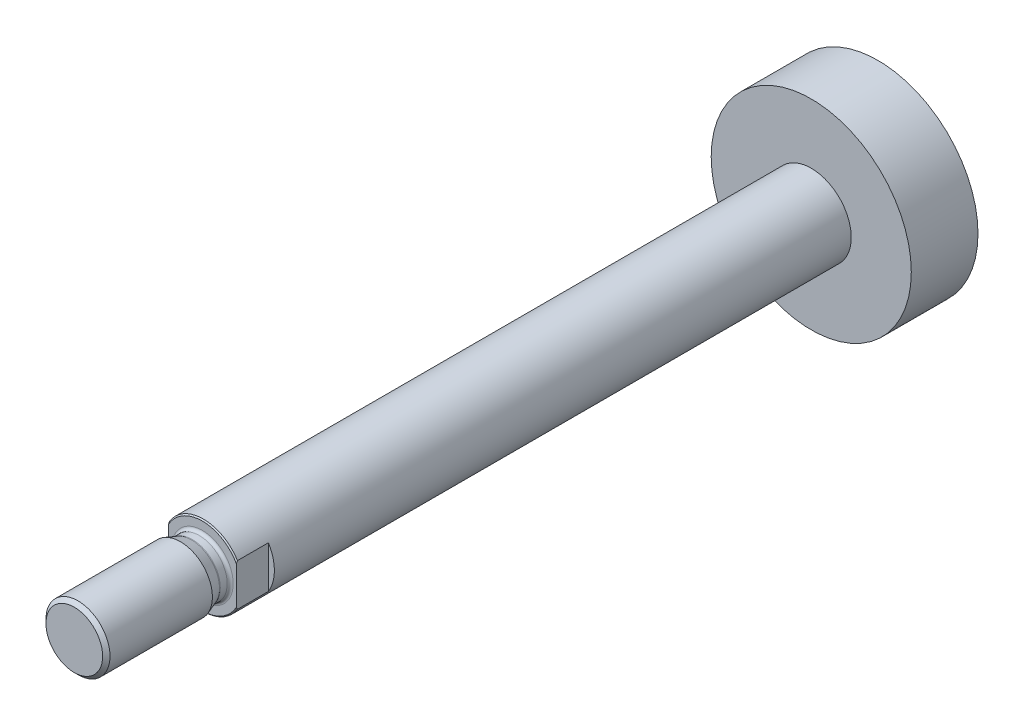
from build123d import *

# Parameters (mm, degrees)
CUT_EXTRUDE1_DEPTH      = 17
CUT_EXTRUDE1_DEPTH_BACK = 17


with BuildPart() as part:
    # Sketch1 → Revolve1 (revolve)
    with BuildSketch(Plane(origin=(0, 0, 0), x_dir=(0, 0, -1), z_dir=(1, 0, 0))):
        Polygon((-35.8, 0), (-35.8, 9.717157288), (-35.517157288, 10), (116.333333333, 10), (116.333333333, 25), (133, 25), (133, 0), align=None)
    revolve(axis=Axis((0, 0, -133), (0, 0, 1)))

    # Sketch2 → Cut-Extrude1 (cut, two sides: drawn at the far end of the back side and taken through both)
    with BuildSketch(Plane(origin=(0, 0, 0), x_dir=(1, 0, 0), z_dir=(0, 1, 0)).offset(-CUT_EXTRUDE1_DEPTH_BACK)):
        Polygon((-17, -61.8), (17, -61.8), (17, -27.8), (8.5, -27.8), (8.5, -43.8), (-8.5, -43.8), (-8.5, -27.8), (-17, -27.8), align=None)
    extrude(amount=CUT_EXTRUDE1_DEPTH + CUT_EXTRUDE1_DEPTH_BACK, mode=Mode.SUBTRACT)

    # Sketch3 → Revolve2 (revolve)
    with BuildSketch(Plane(origin=(0, 0, 0), x_dir=(0, 0, -1), z_dir=(1, 0, 0))):
        with BuildLine():
            Line((-67.8, 0), (-67.8, 7.08))
            Line((-67.8, 7.08), (-66.88, 8))
            Line((-66.88, 8), (-41.28485129, 8))
            Line((-41.28485129, 8), (-38.524269872, 6.995230534))
            ThreePointArc((-38.524269872, 6.995230534), (-38.397990898, 6.961394185), (-38.267754764, 6.95))
            Line((-38.267754764, 6.95), (-36.55, 6.95))
            ThreePointArc((-36.55, 6.95), (-36.019669914, 7.169669914), (-35.8, 7.7))
            Line((-35.8, 7.7), (-35.05, 7.7))
            Line((-35.05, 7.7), (-35.05, 0))
            Line((-35.05, 0), (-67.8, 0))
        make_face()
    revolve(axis=Axis((0, 0, 35.05), (0, 0, 1)))


solid = part.part
